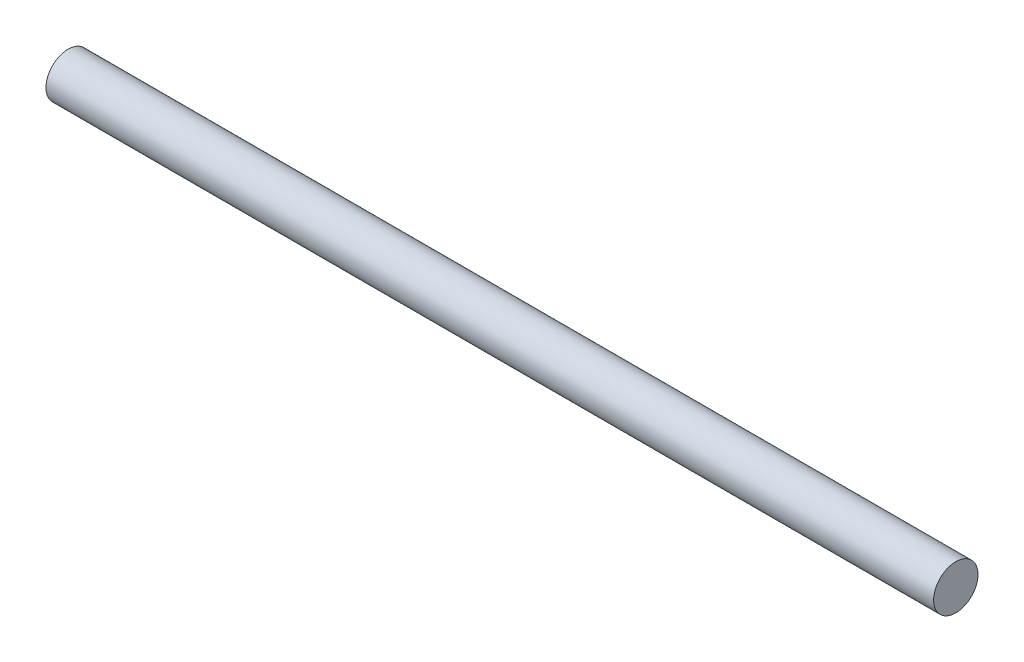
from build123d import *

# Parameters (mm, degrees)
SKETCH1_R           = 6.35
BOSS_EXTRUDE1_DEPTH = 254


with BuildPart() as part:
    # Sketch1 → Boss-Extrude1 (new body)
    with BuildSketch(Plane(origin=(0, 0, 0), x_dir=(0, 0, -1), z_dir=(1, 0, 0))):
        Circle(SKETCH1_R)
    extrude(amount=BOSS_EXTRUDE1_DEPTH)


solid = part.part
